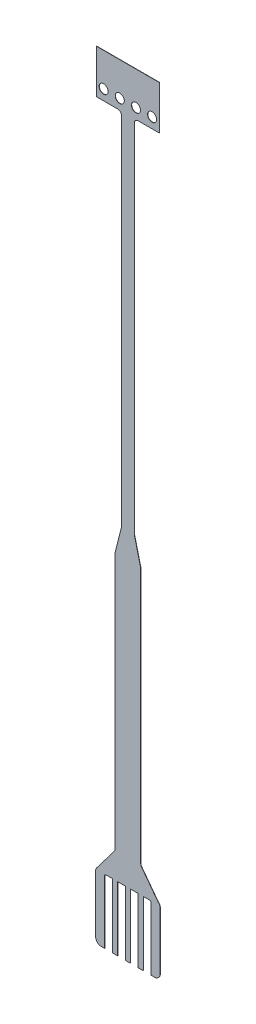
from build123d import *

# Parameters (mm, degrees)
BOSS_EXTRUDE1_DEPTH = 0.01


with BuildPart() as part:
    # Model → Boss-Extrude1 (new body)
    with BuildSketch(Plane.XY):
        Polygon((-1.25, -28.292), (-1.24925, -28.30225), (-1.24825, -28.31225), (-1.2465, -28.32225), (-1.2445, -28.332), (-1.242, -28.34175), (-1.239, -28.3515), (-1.2355, -28.361), (-1.23175, -28.37025), (-1.22725, -28.3795), (-1.2225, -28.3885), (-1.2175, -28.397), (-1.21175, -28.4055), (-1.206, -28.4135), (-1.1995, -28.4215), (-1.19275, -28.429), (-1.18575, -28.43625), (-1.17825, -28.443), (-1.1705, -28.4495), (-1.1625, -28.45575), (-1.15425, -28.4615), (-1.14575, -28.46675), (-1.137, -28.47175), (-1.12775, -28.47625), (-1.1185, -28.48025), (-1.10925, -28.484), (-1.0995, -28.48725), (-1.09, -28.48975), (-1.08, -28.492), (-1.07, -28.494), (-1.06, -28.49525), (-1.05, -28.496), (-0.9, -28.496), (-0.9, -26.04125), (-0.89925, -26.0365), (-0.89825, -26.03175), (-0.8965, -26.027), (-0.89425, -26.02275), (-0.89175, -26.0185), (-0.889, -26.0145), (-0.88575, -26.01075), (-0.882, -26.0075), (-0.878, -26.00475), (-0.87375, -26.00225), (-0.8695, -26), (-0.86475, -25.99825), (-0.86, -25.99725), (-0.85525, -25.9965), (-0.85025, -25.99625), (-0.605, -25.996), (-0.6035, -25.99625), (-0.602, -25.997), (-0.601, -25.998), (-0.60025, -25.9995), (-0.6, -26.001), (-0.6, -28.496), (-0.4, -28.496), (-0.4, -26.001), (-0.39975, -25.9995), (-0.399, -25.998), (-0.398, -25.997), (-0.3965, -25.99625), (-0.395, -25.996), (-0.105, -25.996), (-0.1035, -25.99625), (-0.102, -25.997), (-0.101, -25.998), (-0.10025, -25.9995), (-0.1, -26.001), (-0.1, -28.496), (0.1, -28.496), (0.1, -26.001), (0.10025, -25.9995), (0.101, -25.998), (0.102, -25.997), (0.1035, -25.99625), (0.105, -25.996), (0.395, -25.996), (0.3965, -25.99625), (0.398, -25.997), (0.399, -25.998), (0.39975, -25.9995), (0.4, -26.001), (0.4, -28.496), (0.6, -28.496), (0.6, -26.001), (0.60025, -25.9995), (0.601, -25.998), (0.602, -25.997), (0.6035, -25.99625), (0.605, -25.996), (0.85, -25.996), (0.855, -25.99625), (0.85975, -25.997), (0.8645, -25.998), (0.86925, -25.99975), (0.8735, -26.002), (0.87775, -26.0045), (0.88175, -26.00725), (0.8855, -26.0105), (0.88875, -26.01425), (0.8915, -26.01825), (0.894, -26.0225), (0.89625, -26.02675), (0.898, -26.0315), (0.899, -26.03625), (0.89975, -26.041), (0.9, -26.046), (0.9, -28.496), (1.05, -28.496), (1.06, -28.49525), (1.07, -28.494), (1.08, -28.492), (1.08975, -28.48975), (1.0995, -28.48725), (1.10925, -28.484), (1.1185, -28.48025), (1.12775, -28.47625), (1.137, -28.47175), (1.14575, -28.46675), (1.15425, -28.4615), (1.1625, -28.45575), (1.1705, -28.4495), (1.17825, -28.443), (1.18575, -28.43625), (1.19275, -28.429), (1.1995, -28.4215), (1.206, -28.41375), (1.21175, -28.4055), (1.2175, -28.397), (1.2225, -28.3885), (1.22725, -28.3795), (1.23175, -28.37025), (1.2355, -28.361), (1.239, -28.3515), (1.242, -28.34175), (1.2445, -28.332), (1.2465, -28.32225), (1.24825, -28.31225), (1.24925, -28.30225), (1.25, -28.292), (1.25, -26.046), (1.24975, -26.037), (1.249, -26.028), (1.248, -26.019), (1.24625, -26.01), (1.24425, -26.00125), (1.24175, -25.9925), (1.23875, -25.984), (1.23525, -25.97575), (1.2315, -25.9675), (1.227, -25.9595), (1.2225, -25.95175), (1.21725, -25.94425), (1.212, -25.937), (1.206, -25.93), (1.2, -25.9235), (1.1935, -25.91725), (1.1865, -25.91125), (0.52198, -25.025308), (0.521, -25.02375), (0.517, -25.01675), (0.5135, -25.0095), (0.51025, -25.002), (0.5075, -24.9945), (0.50525, -24.98675), (0.50325, -24.979), (0.50175, -24.971), (0.50075, -24.963), (0.5, -24.955), (0.5, -14.996), (0.25, -13.996), (0.25, -0.15), (0.25025, -0.1415), (0.251, -0.13325), (0.252, -0.12475), (0.25375, -0.1165), (0.25575, -0.1085), (0.2585, -0.1005), (0.2615, -0.0925), (0.26475, -0.085), (0.26875, -0.0775), (0.273, -0.07025), (0.27775, -0.06325), (0.28275, -0.0565), (0.28825, -0.05), (0.294, -0.044), (0.3, -0.03825), (0.3065, -0.03275), (0.31325, -0.02775), (0.32025, -0.023), (0.3275, -0.01875), (0.335, -0.01475), (0.3425, -0.0115), (0.3505, -0.0085), (0.3585, -0.00575), (0.3665, -0.00375), (0.37475, -0.002), (0.38325, -0.001), (0.3915, -0.00025), (0.4, 0), (1.225, 0), (1.225, 1.7), (0.767, 1.7), (0.139, 1.7), (-0.489, 1.7), (-1.117, 1.7), (-1.225, 1.7), (-1.225, 0), (-0.4, 0), (-0.3915, -0.00025), (-0.38325, -0.001), (-0.37475, -0.002), (-0.3665, -0.00375), (-0.3585, -0.00575), (-0.3505, -0.0085), (-0.3425, -0.0115), (-0.335, -0.01475), (-0.3275, -0.01875), (-0.32025, -0.023), (-0.31325, -0.02775), (-0.3065, -0.03275), (-0.3, -0.03825), (-0.294, -0.044), (-0.28825, -0.05), (-0.28275, -0.0565), (-0.27775, -0.06325), (-0.273, -0.07025), (-0.26875, -0.0775), (-0.26475, -0.085), (-0.2615, -0.0925), (-0.2585, -0.1005), (-0.25575, -0.1085), (-0.25375, -0.1165), (-0.252, -0.12475), (-0.251, -0.13325), (-0.25025, -0.1415), (-0.25, -0.15), (-0.25, -13.996), (-0.5, -14.996), (-0.5, -24.948), (-0.50025, -24.956), (-0.50075, -24.964), (-0.502, -24.972), (-0.5035, -24.98), (-0.50525, -24.98775), (-0.50775, -24.9955), (-0.5105, -25.003), (-0.5135, -25.0105), (-0.51725, -25.01775), (-0.519594, -25.022125), (-1.186442, -25.911255), (-1.1935, -25.9175), (-1.2, -25.92375), (-1.20625, -25.93025), (-1.212, -25.93725), (-1.2175, -25.9445), (-1.2225, -25.952), (-1.22725, -25.95975), (-1.2315, -25.96775), (-1.23525, -25.976), (-1.23875, -25.98425), (-1.24175, -25.99275), (-1.24425, -26.0015), (-1.24625, -26.01025), (-1.248, -26.01925), (-1.249, -26.02825), (-1.24975, -26.03725), (-1.249985, -26.045688), align=None)
        Polygon((0.767, 0.4), (0.76725, 0.40675), (0.7675, 0.413), (0.76825, 0.41975), (0.769, 0.42625), (0.77025, 0.43275), (0.7715, 0.439), (0.773, 0.44525), (0.77475, 0.4515), (0.777, 0.458), (0.77925, 0.464), (0.78175, 0.47), (0.78425, 0.47575), (0.7875, 0.482), (0.7905, 0.4875), (0.794, 0.49325), (0.7975, 0.4985), (0.80125, 0.50375), (0.80525, 0.509), (0.80925, 0.514), (0.81375, 0.519), (0.823, 0.52825), (0.828, 0.53275), (0.833, 0.53675), (0.83825, 0.54075), (0.8435, 0.5445), (0.84875, 0.548), (0.8545, 0.5515), (0.86, 0.5545), (0.86625, 0.55775), (0.872, 0.56025), (0.878, 0.56275), (0.884, 0.565), (0.8905, 0.56725), (0.89675, 0.569), (0.903, 0.5705), (0.90925, 0.57175), (0.91575, 0.573), (0.92225, 0.57375), (0.929, 0.5745), (0.93525, 0.57475), (0.942, 0.575), (0.94875, 0.57475), (0.955, 0.5745), (0.96175, 0.57375), (0.96825, 0.573), (0.97475, 0.57175), (0.981, 0.5705), (0.98725, 0.569), (0.9935, 0.56725), (1, 0.565), (1.006, 0.56275), (1.012, 0.56025), (1.01775, 0.55775), (1.024, 0.5545), (1.0295, 0.5515), (1.03525, 0.548), (1.0405, 0.5445), (1.04575, 0.54075), (1.051, 0.53675), (1.056, 0.53275), (1.061, 0.52825), (1.07025, 0.519), (1.07475, 0.514), (1.07875, 0.509), (1.08275, 0.50375), (1.0865, 0.4985), (1.09, 0.49325), (1.0935, 0.4875), (1.0965, 0.482), (1.09975, 0.47575), (1.10225, 0.47), (1.10475, 0.464), (1.107, 0.458), (1.10925, 0.4515), (1.111, 0.44525), (1.1125, 0.439), (1.11375, 0.43275), (1.115, 0.42625), (1.11575, 0.41975), (1.1165, 0.413), (1.11675, 0.40675), (1.117, 0.4), (1.11675, 0.39325), (1.1165, 0.387), (1.11575, 0.38025), (1.115, 0.37375), (1.11375, 0.36725), (1.1125, 0.361), (1.111, 0.35475), (1.10925, 0.3485), (1.107, 0.342), (1.10475, 0.336), (1.10225, 0.33), (1.09975, 0.32425), (1.0965, 0.318), (1.0935, 0.3125), (1.09, 0.30675), (1.0865, 0.3015), (1.08275, 0.29625), (1.07875, 0.291), (1.07475, 0.286), (1.07025, 0.281), (1.061, 0.27175), (1.056, 0.26725), (1.051, 0.26325), (1.04575, 0.25925), (1.0405, 0.2555), (1.03525, 0.252), (1.0295, 0.2485), (1.024, 0.2455), (1.01775, 0.24225), (1.012, 0.23975), (1.006, 0.23725), (1, 0.235), (0.9935, 0.23275), (0.98725, 0.231), (0.981, 0.2295), (0.97475, 0.22825), (0.96825, 0.227), (0.96175, 0.22625), (0.955, 0.2255), (0.94875, 0.22525), (0.942, 0.225), (0.93525, 0.22525), (0.929, 0.2255), (0.92225, 0.22625), (0.91575, 0.227), (0.90925, 0.22825), (0.903, 0.2295), (0.89675, 0.231), (0.8905, 0.23275), (0.884, 0.235), (0.878, 0.23725), (0.872, 0.23975), (0.86625, 0.24225), (0.86, 0.2455), (0.8545, 0.2485), (0.84875, 0.252), (0.8435, 0.2555), (0.83825, 0.25925), (0.833, 0.26325), (0.828, 0.26725), (0.823, 0.27175), (0.81375, 0.281), (0.80925, 0.286), (0.80525, 0.291), (0.80125, 0.29625), (0.7975, 0.3015), (0.794, 0.30675), (0.7905, 0.3125), (0.7875, 0.318), (0.78425, 0.32425), (0.78175, 0.33), (0.77925, 0.336), (0.777, 0.342), (0.77475, 0.3485), (0.773, 0.35475), (0.7715, 0.361), (0.77025, 0.36725), (0.769, 0.37375), (0.76825, 0.38025), (0.7675, 0.387), (0.76725, 0.39325), align=None, mode=Mode.SUBTRACT)
        Polygon((0.139, 0.4), (0.13925, 0.40675), (0.1395, 0.413), (0.14025, 0.41975), (0.141, 0.42625), (0.14225, 0.43275), (0.1435, 0.439), (0.145, 0.44525), (0.14675, 0.4515), (0.149, 0.458), (0.15125, 0.464), (0.15375, 0.47), (0.15625, 0.47575), (0.1595, 0.482), (0.1625, 0.4875), (0.166, 0.49325), (0.1695, 0.4985), (0.17325, 0.50375), (0.17725, 0.509), (0.18125, 0.514), (0.18575, 0.519), (0.195, 0.52825), (0.2, 0.53275), (0.205, 0.53675), (0.21025, 0.54075), (0.2155, 0.5445), (0.22075, 0.548), (0.2265, 0.5515), (0.232, 0.5545), (0.23825, 0.55775), (0.244, 0.56025), (0.25, 0.56275), (0.256, 0.565), (0.2625, 0.56725), (0.26875, 0.569), (0.275, 0.5705), (0.28125, 0.57175), (0.28775, 0.573), (0.29425, 0.57375), (0.301, 0.5745), (0.30725, 0.57475), (0.314, 0.575), (0.32075, 0.57475), (0.327, 0.5745), (0.33375, 0.57375), (0.34025, 0.573), (0.34675, 0.57175), (0.353, 0.5705), (0.35925, 0.569), (0.3655, 0.56725), (0.372, 0.565), (0.378, 0.56275), (0.384, 0.56025), (0.38975, 0.55775), (0.396, 0.5545), (0.4015, 0.5515), (0.40725, 0.548), (0.4125, 0.5445), (0.41775, 0.54075), (0.423, 0.53675), (0.428, 0.53275), (0.433, 0.52825), (0.44225, 0.519), (0.44675, 0.514), (0.45075, 0.509), (0.45475, 0.50375), (0.4585, 0.4985), (0.462, 0.49325), (0.4655, 0.4875), (0.4685, 0.482), (0.47175, 0.47575), (0.47425, 0.47), (0.47675, 0.464), (0.479, 0.458), (0.48125, 0.4515), (0.483, 0.44525), (0.4845, 0.439), (0.48575, 0.43275), (0.487, 0.42625), (0.48775, 0.41975), (0.4885, 0.413), (0.48875, 0.40675), (0.489, 0.4), (0.48875, 0.39325), (0.4885, 0.387), (0.48775, 0.38025), (0.487, 0.37375), (0.48575, 0.36725), (0.4845, 0.361), (0.483, 0.35475), (0.48125, 0.3485), (0.479, 0.342), (0.47675, 0.336), (0.47425, 0.33), (0.47175, 0.32425), (0.4685, 0.318), (0.4655, 0.3125), (0.462, 0.30675), (0.4585, 0.3015), (0.45475, 0.29625), (0.45075, 0.291), (0.44675, 0.286), (0.44225, 0.281), (0.433, 0.27175), (0.428, 0.26725), (0.423, 0.26325), (0.41775, 0.25925), (0.4125, 0.2555), (0.40725, 0.252), (0.4015, 0.2485), (0.396, 0.2455), (0.38975, 0.24225), (0.384, 0.23975), (0.378, 0.23725), (0.372, 0.235), (0.3655, 0.23275), (0.35925, 0.231), (0.353, 0.2295), (0.34675, 0.22825), (0.34025, 0.227), (0.33375, 0.22625), (0.327, 0.2255), (0.32075, 0.22525), (0.314, 0.225), (0.30725, 0.22525), (0.301, 0.2255), (0.29425, 0.22625), (0.28775, 0.227), (0.28125, 0.22825), (0.275, 0.2295), (0.26875, 0.231), (0.2625, 0.23275), (0.256, 0.235), (0.25, 0.23725), (0.244, 0.23975), (0.23825, 0.24225), (0.232, 0.2455), (0.2265, 0.2485), (0.22075, 0.252), (0.2155, 0.2555), (0.21025, 0.25925), (0.205, 0.26325), (0.2, 0.26725), (0.195, 0.27175), (0.18575, 0.281), (0.18125, 0.286), (0.17725, 0.291), (0.17325, 0.29625), (0.1695, 0.3015), (0.166, 0.30675), (0.1625, 0.3125), (0.1595, 0.318), (0.15625, 0.32425), (0.15375, 0.33), (0.15125, 0.336), (0.149, 0.342), (0.14675, 0.3485), (0.145, 0.35475), (0.1435, 0.361), (0.14225, 0.36725), (0.141, 0.37375), (0.14025, 0.38025), (0.1395, 0.387), (0.13925, 0.39325), align=None, mode=Mode.SUBTRACT)
        Polygon((-0.489, 0.4), (-0.48875, 0.40675), (-0.4885, 0.413), (-0.48775, 0.41975), (-0.487, 0.42625), (-0.48575, 0.43275), (-0.4845, 0.439), (-0.483, 0.44525), (-0.48125, 0.4515), (-0.479, 0.458), (-0.47675, 0.464), (-0.47425, 0.47), (-0.47175, 0.47575), (-0.4685, 0.482), (-0.4655, 0.4875), (-0.462, 0.49325), (-0.4585, 0.4985), (-0.45475, 0.50375), (-0.45075, 0.509), (-0.44675, 0.514), (-0.44225, 0.519), (-0.433, 0.52825), (-0.428, 0.53275), (-0.423, 0.53675), (-0.41775, 0.54075), (-0.4125, 0.5445), (-0.40725, 0.548), (-0.4015, 0.5515), (-0.396, 0.5545), (-0.38975, 0.55775), (-0.384, 0.56025), (-0.378, 0.56275), (-0.372, 0.565), (-0.3655, 0.56725), (-0.35925, 0.569), (-0.353, 0.5705), (-0.34675, 0.57175), (-0.34025, 0.573), (-0.33375, 0.57375), (-0.327, 0.5745), (-0.32075, 0.57475), (-0.314, 0.575), (-0.30725, 0.57475), (-0.301, 0.5745), (-0.29425, 0.57375), (-0.28775, 0.573), (-0.28125, 0.57175), (-0.275, 0.5705), (-0.26875, 0.569), (-0.2625, 0.56725), (-0.256, 0.565), (-0.25, 0.56275), (-0.244, 0.56025), (-0.23825, 0.55775), (-0.232, 0.5545), (-0.2265, 0.5515), (-0.22075, 0.548), (-0.2155, 0.5445), (-0.21025, 0.54075), (-0.205, 0.53675), (-0.2, 0.53275), (-0.195, 0.52825), (-0.18575, 0.519), (-0.18125, 0.514), (-0.17725, 0.509), (-0.17325, 0.50375), (-0.1695, 0.4985), (-0.166, 0.49325), (-0.1625, 0.4875), (-0.1595, 0.482), (-0.15625, 0.47575), (-0.15375, 0.47), (-0.15125, 0.464), (-0.149, 0.458), (-0.14675, 0.4515), (-0.145, 0.44525), (-0.1435, 0.439), (-0.14225, 0.43275), (-0.141, 0.42625), (-0.14025, 0.41975), (-0.1395, 0.413), (-0.13925, 0.40675), (-0.139, 0.4), (-0.13925, 0.39325), (-0.1395, 0.387), (-0.14025, 0.38025), (-0.141, 0.37375), (-0.14225, 0.36725), (-0.1435, 0.361), (-0.145, 0.35475), (-0.14675, 0.3485), (-0.149, 0.342), (-0.15125, 0.336), (-0.15375, 0.33), (-0.15625, 0.32425), (-0.1595, 0.318), (-0.1625, 0.3125), (-0.166, 0.30675), (-0.1695, 0.3015), (-0.17325, 0.29625), (-0.17725, 0.291), (-0.18125, 0.286), (-0.18575, 0.281), (-0.195, 0.27175), (-0.2, 0.26725), (-0.205, 0.26325), (-0.21025, 0.25925), (-0.2155, 0.2555), (-0.22075, 0.252), (-0.2265, 0.2485), (-0.232, 0.2455), (-0.23825, 0.24225), (-0.244, 0.23975), (-0.25, 0.23725), (-0.256, 0.235), (-0.2625, 0.23275), (-0.26875, 0.231), (-0.275, 0.2295), (-0.28125, 0.22825), (-0.28775, 0.227), (-0.29425, 0.22625), (-0.301, 0.2255), (-0.30725, 0.22525), (-0.314, 0.225), (-0.32075, 0.22525), (-0.327, 0.2255), (-0.33375, 0.22625), (-0.34025, 0.227), (-0.34675, 0.22825), (-0.353, 0.2295), (-0.35925, 0.231), (-0.3655, 0.23275), (-0.372, 0.235), (-0.378, 0.23725), (-0.384, 0.23975), (-0.38975, 0.24225), (-0.396, 0.2455), (-0.4015, 0.2485), (-0.40725, 0.252), (-0.4125, 0.2555), (-0.41775, 0.25925), (-0.423, 0.26325), (-0.428, 0.26725), (-0.433, 0.27175), (-0.44225, 0.281), (-0.44675, 0.286), (-0.45075, 0.291), (-0.45475, 0.29625), (-0.4585, 0.3015), (-0.462, 0.30675), (-0.4655, 0.3125), (-0.4685, 0.318), (-0.47175, 0.32425), (-0.47425, 0.33), (-0.47675, 0.336), (-0.479, 0.342), (-0.48125, 0.3485), (-0.483, 0.35475), (-0.4845, 0.361), (-0.48575, 0.36725), (-0.487, 0.37375), (-0.48775, 0.38025), (-0.4885, 0.387), (-0.48875, 0.39325), align=None, mode=Mode.SUBTRACT)
        Polygon((-1.117, 0.4), (-1.11675, 0.40675), (-1.1165, 0.413), (-1.11575, 0.41975), (-1.115, 0.42625), (-1.11375, 0.43275), (-1.1125, 0.439), (-1.111, 0.44525), (-1.10925, 0.4515), (-1.107, 0.458), (-1.10475, 0.464), (-1.10225, 0.47), (-1.09975, 0.47575), (-1.0965, 0.482), (-1.0935, 0.4875), (-1.09, 0.49325), (-1.0865, 0.4985), (-1.08275, 0.50375), (-1.07875, 0.509), (-1.07475, 0.514), (-1.07025, 0.519), (-1.061, 0.52825), (-1.056, 0.53275), (-1.051, 0.53675), (-1.04575, 0.54075), (-1.0405, 0.5445), (-1.03525, 0.548), (-1.0295, 0.5515), (-1.024, 0.5545), (-1.01775, 0.55775), (-1.012, 0.56025), (-1.006, 0.56275), (-1, 0.565), (-0.9935, 0.56725), (-0.98725, 0.569), (-0.981, 0.5705), (-0.97475, 0.57175), (-0.96825, 0.573), (-0.96175, 0.57375), (-0.955, 0.5745), (-0.94875, 0.57475), (-0.942, 0.575), (-0.93525, 0.57475), (-0.929, 0.5745), (-0.92225, 0.57375), (-0.91575, 0.573), (-0.90925, 0.57175), (-0.903, 0.5705), (-0.89675, 0.569), (-0.8905, 0.56725), (-0.884, 0.565), (-0.878, 0.56275), (-0.872, 0.56025), (-0.86625, 0.55775), (-0.86, 0.5545), (-0.8545, 0.5515), (-0.84875, 0.548), (-0.8435, 0.5445), (-0.83825, 0.54075), (-0.833, 0.53675), (-0.828, 0.53275), (-0.823, 0.52825), (-0.81375, 0.519), (-0.80925, 0.514), (-0.80525, 0.509), (-0.80125, 0.50375), (-0.7975, 0.4985), (-0.794, 0.49325), (-0.7905, 0.4875), (-0.7875, 0.482), (-0.78425, 0.47575), (-0.78175, 0.47), (-0.77925, 0.464), (-0.777, 0.458), (-0.77475, 0.4515), (-0.773, 0.44525), (-0.7715, 0.439), (-0.77025, 0.43275), (-0.769, 0.42625), (-0.76825, 0.41975), (-0.7675, 0.413), (-0.76725, 0.40675), (-0.767, 0.4), (-0.76725, 0.39325), (-0.7675, 0.387), (-0.76825, 0.38025), (-0.769, 0.37375), (-0.77025, 0.36725), (-0.7715, 0.361), (-0.773, 0.35475), (-0.77475, 0.3485), (-0.777, 0.342), (-0.77925, 0.336), (-0.78175, 0.33), (-0.78425, 0.32425), (-0.7875, 0.318), (-0.7905, 0.3125), (-0.794, 0.30675), (-0.7975, 0.3015), (-0.80125, 0.29625), (-0.80525, 0.291), (-0.80925, 0.286), (-0.81375, 0.281), (-0.823, 0.27175), (-0.828, 0.26725), (-0.833, 0.26325), (-0.83825, 0.25925), (-0.8435, 0.2555), (-0.84875, 0.252), (-0.8545, 0.2485), (-0.86, 0.2455), (-0.86625, 0.24225), (-0.872, 0.23975), (-0.878, 0.23725), (-0.884, 0.235), (-0.8905, 0.23275), (-0.89675, 0.231), (-0.903, 0.2295), (-0.90925, 0.22825), (-0.91575, 0.227), (-0.92225, 0.22625), (-0.929, 0.2255), (-0.93525, 0.22525), (-0.942, 0.225), (-0.94875, 0.22525), (-0.955, 0.2255), (-0.96175, 0.22625), (-0.96825, 0.227), (-0.97475, 0.22825), (-0.981, 0.2295), (-0.98725, 0.231), (-0.9935, 0.23275), (-1, 0.235), (-1.006, 0.23725), (-1.012, 0.23975), (-1.01775, 0.24225), (-1.024, 0.2455), (-1.0295, 0.2485), (-1.03525, 0.252), (-1.0405, 0.2555), (-1.04575, 0.25925), (-1.051, 0.26325), (-1.056, 0.26725), (-1.061, 0.27175), (-1.07025, 0.281), (-1.07475, 0.286), (-1.07875, 0.291), (-1.08275, 0.29625), (-1.0865, 0.3015), (-1.09, 0.30675), (-1.0935, 0.3125), (-1.0965, 0.318), (-1.09975, 0.32425), (-1.10225, 0.33), (-1.10475, 0.336), (-1.107, 0.342), (-1.10925, 0.3485), (-1.111, 0.35475), (-1.1125, 0.361), (-1.11375, 0.36725), (-1.115, 0.37375), (-1.11575, 0.38025), (-1.1165, 0.387), (-1.11675, 0.39325), align=None, mode=Mode.SUBTRACT)
    extrude(amount=BOSS_EXTRUDE1_DEPTH)


solid = part.part
